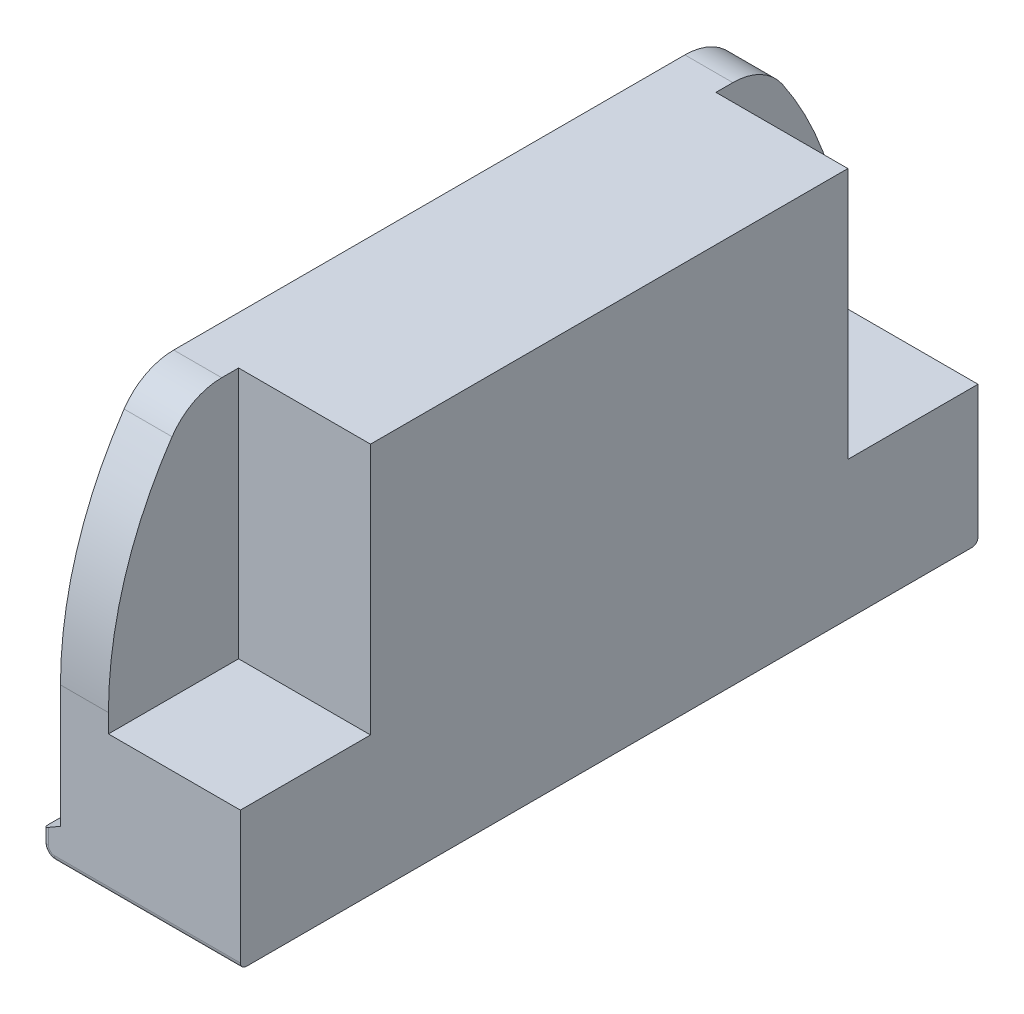
from build123d import *

# Parameters (mm, degrees)
BOSS_EXTRUDE1_DEPTH = 12.3
SKETCH2_W           = 2.2
SKETCH2_H           = 2.17
CUT_EXTRUDE1_DEPTH  = 4.2
CUT_EXTRUDE3_DEPTH  = 0.8
SKETCH5_W           = 3
SKETCH5_H           = 1
BOSS_EXTRUDE2_DEPTH = 0.4
BOSS_EXTRUDE3_DEPTH = 3
FILLET1_R           = 0.1


with BuildPart() as part:
    # Sketch1 → Boss-Extrude1 (new body)
    with BuildSketch(Plane.XY):
        with BuildLine():
            Line((0, 0), (0.299997713, 0.173208719))
            Line((0.299997713, 0.173208719), (0.299997713, 1.781598719))
            Line((0.299997713, 1.781598719), (0.299997713, 6.107458719))
            Line((0.299997713, 6.107458719), (3.299997713, 6.107458719))
            Line((3.299997713, 6.107458719), (3.299997713, 0.646828719))
            Line((3.299997713, 0.646828719), (3.299997713, -0.4))
            Line((3.299997713, -0.4), (0.2, -0.4))
            ThreePointArc((0.2, -0.4), (0.058578644, -0.341421356), (0, -0.2))
            Line((0, -0.2), (0, 0))
        make_face()
    extrude(amount=BOSS_EXTRUDE1_DEPTH)

    # Sketch2 → Cut-Extrude1 (cut)
    with BuildSketch(Plane(origin=(0, 6.107458719, 0), x_dir=(1, 0, 0), z_dir=(0, 1, 0))):
        with Locations((2.199997713, -1.085)):
            Rectangle(SKETCH2_W, SKETCH2_H)
        with Locations((2.199997713, -11.215)):
            Rectangle(SKETCH2_W, SKETCH2_H)
    extrude(amount=-CUT_EXTRUDE1_DEPTH, mode=Mode.SUBTRACT)

    # Sketch4 → Cut-Extrude3 (cut)
    with BuildSketch(Plane.ZY.offset(-0.299997713)):
        with BuildLine():
            Line((10.41158, 6.107458719), (12.3, 6.107458719))
            Line((12.3, 6.107458719), (12.3, 2.215929667))
            ThreePointArc((12.3, 2.215929667), (12.02880398, 4.022129667), (11.23913234, 5.669043272))
            ThreePointArc((11.23913234, 5.669043272), (10.879869522, 5.991150317), (10.41158, 6.107458719))
        make_face()
        with BuildLine():
            Line((1.88842, 6.107458719), (0, 6.107458719))
            Line((0, 6.107458719), (0, 2.215929667))
            ThreePointArc((0, 2.215929667), (0.27119602, 4.022129667), (1.06086766, 5.669043272))
            ThreePointArc((1.06086766, 5.669043272), (1.420130478, 5.991150317), (1.88842, 6.107458719))
        make_face()
    extrude(amount=-CUT_EXTRUDE3_DEPTH, mode=Mode.SUBTRACT)

    # Sketch5 → Boss-Extrude2 (add)
    with BuildSketch(Plane.ZY.offset(-0.299997713)):
        with Locations((6.15, 2.281598719)):
            Rectangle(SKETCH5_W, SKETCH5_H)
    extrude(amount=BOSS_EXTRUDE2_DEPTH)

    # Sketch6 → Boss-Extrude3 (add)
    with BuildSketch(Plane.XY.offset(7.65)):
        Polygon((0.299997713, 2.781598719), (0.299997713, 4.373208719), (-0.100002287, 2.781598719), align=None)
    extrude(amount=-BOSS_EXTRUDE3_DEPTH)

    # Fillet1
    fillet1_edges = [part.edges().sort_by_distance(p)[0] for p in [
        (1.749998857, -0.4, 12.3),
        (1.749998857, -0.4, 0),
        (0.058578644, -0.341421356, 0),
        (0, -0.1, 0),
        (0, -0.1, 12.3),
        (0.058578644, -0.341421356, 12.3),
    ]]
    fillet(fillet1_edges, radius=FILLET1_R)


solid = part.part
